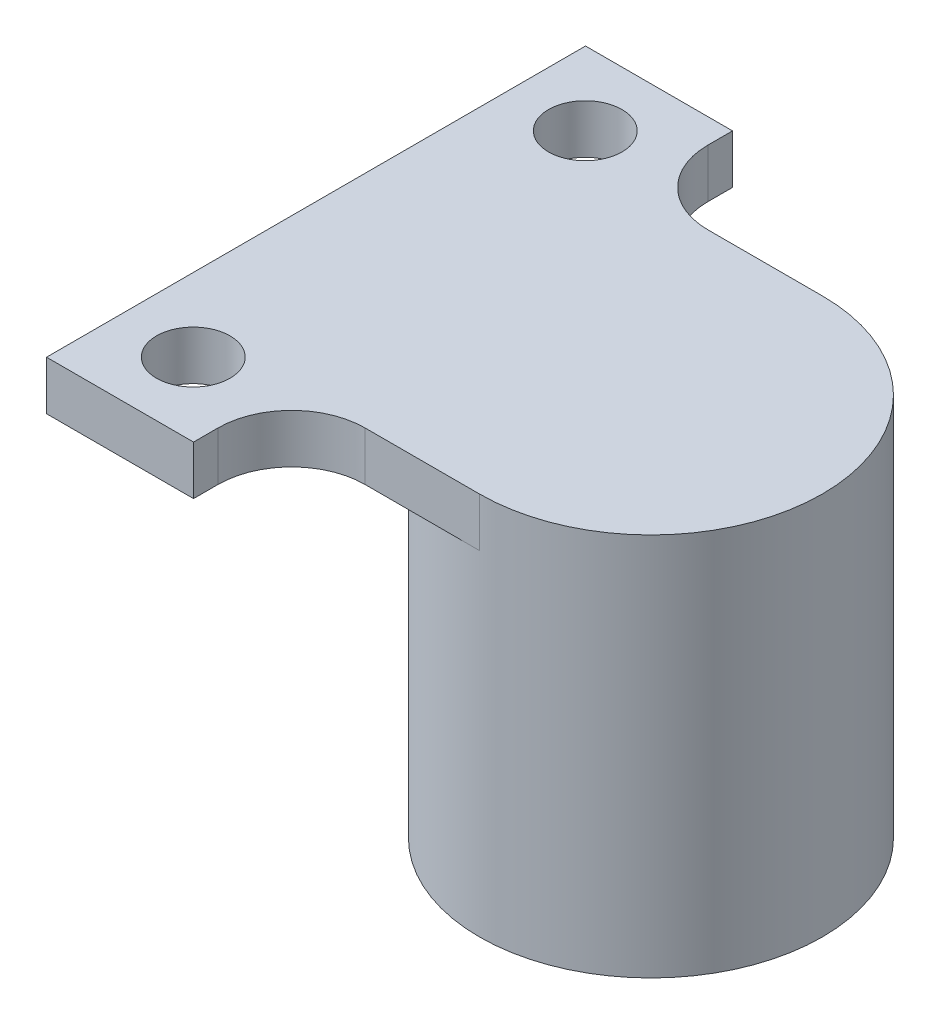
from build123d import *

# Parameters (mm, degrees)
SKETCH1_R           = 7
SKETCH1_R_2         = 5.2
BOSS_EXTRUDE1_DEPTH = 15.66
BOSS_EXTRUDE2_START = -2
SKETCH2_W           = 6
SKETCH2_H           = 4
BOSS_EXTRUDE2_DEPTH = 2
SKETCH4_R           = 1.5
CUT_EXTRUDE1_DEPTH  = 10
FILLET1_R           = 3
BOSS_EXTRUDE3_START = -1
SKETCH5_R           = 5.2
BOSS_EXTRUDE3_DEPTH = 1


with BuildPart() as part:
    # Sketch1 → Boss-Extrude1 (new body)
    with BuildSketch(Plane(origin=(0, 0, 0), x_dir=(1, 0, 0), z_dir=(0, 1, 0))):
        with Locations(Location((0, 0, 0), (0, 0, 270))):
            Circle(SKETCH1_R)
        with Locations(Location((0, 0, 0), (0, 0, 270))):
            Circle(SKETCH1_R_2, mode=Mode.SUBTRACT)
    extrude(amount=BOSS_EXTRUDE1_DEPTH)

    # Sketch2 → Boss-Extrude2 (add)
    with BuildSketch(Plane(origin=(0, 15.66, 0), x_dir=(1, 0, 0), z_dir=(0, 1, 0)).offset(BOSS_EXTRUDE2_START)):
        with Locations((-10.67, -9)):
            Rectangle(SKETCH2_W, SKETCH2_H)
        with BuildLine():
            ThreePointArc((0, -7), (-7, 0), (0, 7))
            Line((0, 7), (-7.67, 7))
            Line((-7.67, 7), (-13.67, 7))
            Line((-13.67, 7), (-13.67, -7))
            Line((-13.67, -7), (-7.67, -7))
            Line((-7.67, -7), (0, -7))
        make_face()
        with Locations((-10.67, 9)):
            Rectangle(SKETCH2_W, SKETCH2_H)
    extrude(amount=BOSS_EXTRUDE2_DEPTH)

    # Sketch4 → Cut-Extrude1 (cut)
    with BuildSketch(Plane.XZ.offset(-13.66)):
        with Locations(Location((-10.68, -8, 0), (0, 0, 270))):
            Circle(SKETCH4_R)
        with Locations(Location((-10.68, 8, 0), (0, 0, 270))):
            Circle(SKETCH4_R)
    extrude(amount=-CUT_EXTRUDE1_DEPTH, mode=Mode.SUBTRACT)

    # Fillet1
    fillet1_edges = [part.edges().sort_by_distance(p)[0] for p in [
        (-7.67, 14.66, 7),
        (-7.67, 14.66, -7),
    ]]
    fillet(fillet1_edges, radius=FILLET1_R)

    # Sketch5 → Boss-Extrude3 (add)
    with BuildSketch(Plane(origin=(0, 15.66, 0), x_dir=(1, 0, 0), z_dir=(0, 1, 0)).offset(BOSS_EXTRUDE3_START)):
        with Locations(Location((0, 0, 0), (0, 0, 270))):
            Circle(SKETCH5_R)
    extrude(amount=BOSS_EXTRUDE3_DEPTH)


solid = part.part
